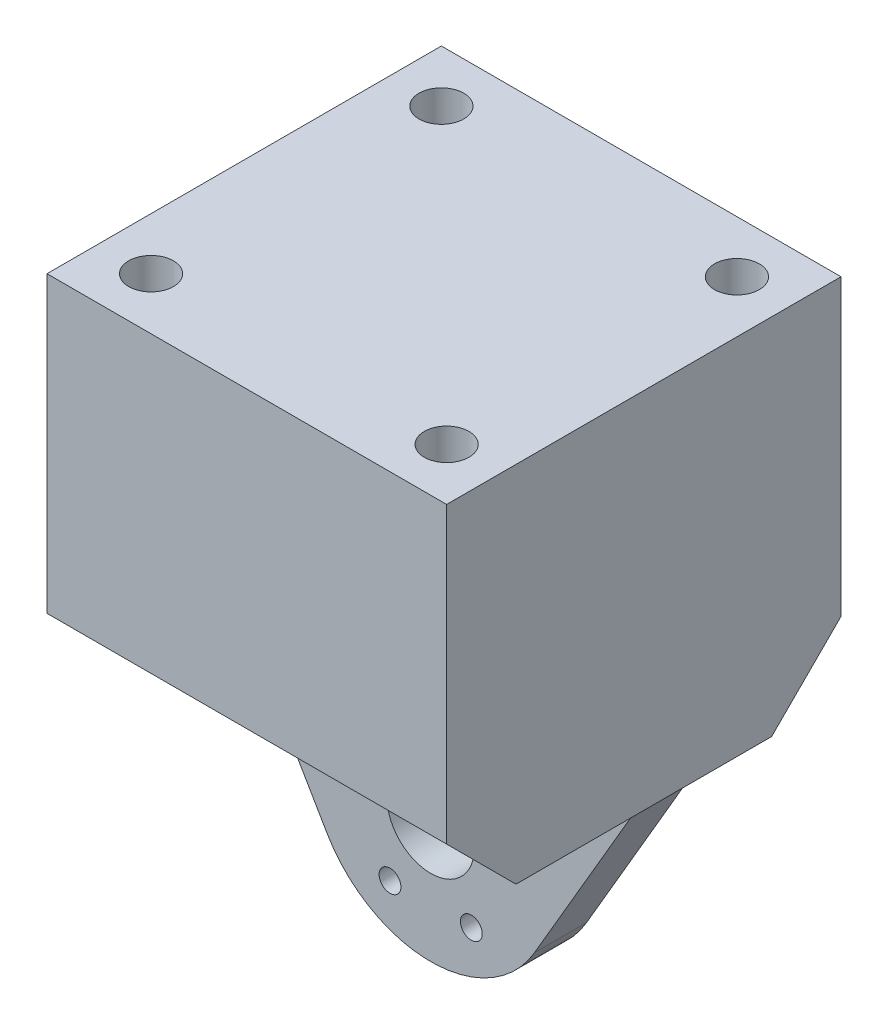
from build123d import *

# Parameters (mm, degrees)
BEARING_MOUNT_BLOCK_DEPTH                      = 31.0134
BEARING_MOUNT_BLOCK_DEPTH_BACK                 = 5.08
SKETCH1_W                                      = 36.576
SKETCH1_H                                      = 33.274
CBORE_FOR_4_SOCKET_HEAD_CAP_SCREW1_D           = 3.2639
CBORE_FOR_4_SOCKET_HEAD_CAP_SCREW1_DEPTH       = 15.875
CBORE_FOR_4_SOCKET_HEAD_CAP_SCREW1_CBORE_D     = 4.09575
CBORE_FOR_4_SOCKET_HEAD_CAP_SCREW1_CBORE_DEPTH = 4.7625
CBORE_FOR_4_SOCKET_HEAD_CAP_SCREW1_TIP         = 0.980574487
CBORE_FOR_4_SOCKET_HEAD_CAP_SCREW2_D           = 3.2639
CBORE_FOR_4_SOCKET_HEAD_CAP_SCREW2_DEPTH       = 15.875
CBORE_FOR_4_SOCKET_HEAD_CAP_SCREW2_CBORE_D     = 4.09575
CBORE_FOR_4_SOCKET_HEAD_CAP_SCREW2_CBORE_DEPTH = 4.7625
CBORE_FOR_4_SOCKET_HEAD_CAP_SCREW2_TIP         = 0.980574487
SKETCH14_R                                     = 4.0005
ENCODER_MOUNTING_FLANGE_DEPTH                  = 4.7625
ENCODER_MOUNTING_HOLES_3_48_D                  = 1.9939
ENCODER_MOUNTING_HOLES_3_48_DEPTH              = 7.62
ENCODER_MOUNTING_HOLES_3_48_TIP                = 0.599027994
MATERIAL_REDUCTION_CHAMFER_SIZE                = 6.35
MATERIAL_REDUCTION_CHAMFER_2_SIZE              = 6.35
ENCODER_CLEARANCE_CUT_DEPTH                    = 47.706097118
TAPPING_CHAMFER_SIZE                           = 0.762


with BuildPart() as part:
    # Sketch1 → Bearing Mount Block (new, two sides: drawn at the far end of the back side and taken through both)
    with BuildSketch(Plane.XY.offset(-BEARING_MOUNT_BLOCK_DEPTH_BACK)):
        Rectangle(SKETCH1_W, SKETCH1_H)
    extrude(amount=BEARING_MOUNT_BLOCK_DEPTH + BEARING_MOUNT_BLOCK_DEPTH_BACK)

    # CBORE for #4 Socket Head Cap Screw1
    with Locations(Plane(origin=(-14.2875, -16.637, 18.3134), x_dir=(0, 0, -1), z_dir=(0, -1, 0))):
        with Locations((0, 0), (0, 28.575)):
            CounterBoreHole(CBORE_FOR_4_SOCKET_HEAD_CAP_SCREW1_D / 2, CBORE_FOR_4_SOCKET_HEAD_CAP_SCREW1_CBORE_D / 2, CBORE_FOR_4_SOCKET_HEAD_CAP_SCREW1_CBORE_DEPTH, depth=CBORE_FOR_4_SOCKET_HEAD_CAP_SCREW1_DEPTH)
            with Locations((0, 0, -(CBORE_FOR_4_SOCKET_HEAD_CAP_SCREW1_DEPTH + CBORE_FOR_4_SOCKET_HEAD_CAP_SCREW1_TIP / 2))):  # 118° drill point
                Cone(0, CBORE_FOR_4_SOCKET_HEAD_CAP_SCREW1_D / 2, CBORE_FOR_4_SOCKET_HEAD_CAP_SCREW1_TIP, mode=Mode.SUBTRACT)

    # CBORE for #4 Socket Head Cap Screw2
    with Locations(Plane(origin=(0, 16.637, 0), x_dir=(1, 0, 0), z_dir=(0, 1, 0))):
        with Locations((13.5255, 0.3175), (13.5255, -26.2509), (-13.5255, -26.2509), (-13.5255, 0.3175)):
            CounterBoreHole(CBORE_FOR_4_SOCKET_HEAD_CAP_SCREW2_D / 2, CBORE_FOR_4_SOCKET_HEAD_CAP_SCREW2_CBORE_D / 2, CBORE_FOR_4_SOCKET_HEAD_CAP_SCREW2_CBORE_DEPTH, depth=CBORE_FOR_4_SOCKET_HEAD_CAP_SCREW2_DEPTH)
            with Locations((0, 0, -(CBORE_FOR_4_SOCKET_HEAD_CAP_SCREW2_DEPTH + CBORE_FOR_4_SOCKET_HEAD_CAP_SCREW2_TIP / 2))):  # 118° drill point
                Cone(0, CBORE_FOR_4_SOCKET_HEAD_CAP_SCREW2_D / 2, CBORE_FOR_4_SOCKET_HEAD_CAP_SCREW2_TIP, mode=Mode.SUBTRACT)

    # Sketch14 → Encoder Mounting Flange (add)
    with BuildSketch(Plane.XY.offset(14.1859)):
        with BuildLine():
            Line((18.288, -16.637), (9.500261866, -31.703247849))
            ThreePointArc((9.500261866, -31.703247849), (0, -37.1602), (-9.500261866, -31.703247849))
            Line((-9.500261866, -31.703247849), (-18.288, -16.637))
            Line((-18.288, -16.637), (18.288, -16.637))
        make_face()
        with Locations((0, -26.162)):
            Circle(SKETCH14_R, mode=Mode.SUBTRACT)
    extrude(amount=-ENCODER_MOUNTING_FLANGE_DEPTH)

    # Encoder Mounting Holes (#3-48)
    with Locations(Plane(origin=(0, 0, 9.4234), x_dir=(-1, 0, 0), z_dir=(0, 0, -1))):
        with Locations((-3.7211, -32.60713426), (3.7211, -19.71686574), (3.7211, -32.60713426), (-3.7211, -19.71686574)):
            Hole(ENCODER_MOUNTING_HOLES_3_48_D / 2, depth=ENCODER_MOUNTING_HOLES_3_48_DEPTH)
            with Locations((0, 0, -(ENCODER_MOUNTING_HOLES_3_48_DEPTH + ENCODER_MOUNTING_HOLES_3_48_TIP / 2))):  # 118° drill point
                Cone(0, ENCODER_MOUNTING_HOLES_3_48_D / 2, ENCODER_MOUNTING_HOLES_3_48_TIP, mode=Mode.SUBTRACT)

    # Material Reduction Chamfer
    material_reduction_chamfer_edges = [part.edges().sort_by_distance(p)[0] for p in [
        (0, -16.637, 31.0134),
    ]]
    chamfer(material_reduction_chamfer_edges, length=MATERIAL_REDUCTION_CHAMFER_SIZE)

    # Material Reduction Chamfer 2
    material_reduction_chamfer_2_edges = [part.edges().sort_by_distance(p)[0] for p in [
        (0, -16.637, -5.08),
    ]]
    chamfer(material_reduction_chamfer_2_edges, length=MATERIAL_REDUCTION_CHAMFER_2_SIZE)

    # Sketch18 → Encoder Clearance Cut (cut, through all)
    with BuildSketch(Plane(origin=(0, 0, 9.4234), x_dir=(-1, 0, 0), z_dir=(0, 0, -1))):
        with BuildLine():
            Line((12.625716354, -24.7904), (-12.625716354, -24.7904))
            ThreePointArc((-12.625716354, -24.7904), (0, -13.462), (12.625716354, -24.7904))
        make_face()
    extrude(amount=ENCODER_CLEARANCE_CUT_DEPTH, mode=Mode.SUBTRACT)

    # Tapping Chamfer
    tapping_chamfer_edges = [part.edges().sort_by_distance(p)[0] for p in [
        (2.72415, -19.71686574, 9.4234),
        (-4.71805, -32.60713426, 9.4234),
        (-4.71805, -19.71686574, 9.4234),
        (2.72415, -32.60713426, 9.4234),
    ]]
    chamfer(tapping_chamfer_edges, length=TAPPING_CHAMFER_SIZE)


solid = part.part
